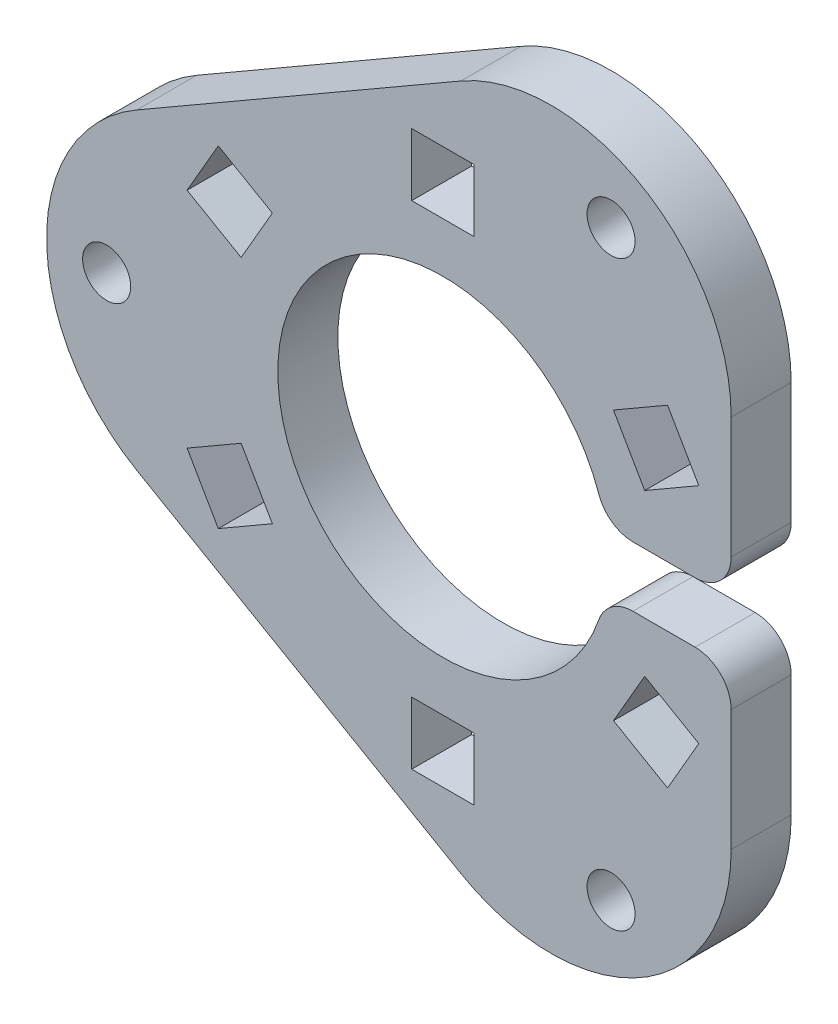
from build123d import *

# Parameters (mm, degrees)
SKETCH1_R           = 2
SKETCH1_W           = 5.2
SKETCH1_H           = 5.2
BOSS_EXTRUDE1_DEPTH = 5
CONG_1_R            = 15
CONG_2_R            = 3


with BuildPart() as part:
    # Sketch1 → Boss-Extrude1 (new body)
    with BuildSketch(Plane.XY):
        with BuildLine():
            Line((24, 2.5), (13.520817283, 2.5))
            ThreePointArc((13.520817283, 2.5), (-13.75, 0), (13.520817283, -2.5))
            Line((13.520817283, -2.5), (24, -2.5))
            Line((24, -2.5), (24, -41.569219382))
            Line((24, -41.569219382), (-48, 0))
            Line((-48, 0), (24, 41.569219382))
            Line((24, 41.569219382), (24, 2.5))
        make_face()
        with Locations((14, 24.248711306)):
            Circle(SKETCH1_R, mode=Mode.SUBTRACT)
        with Locations((14, -24.248711306)):
            Circle(SKETCH1_R, mode=Mode.SUBTRACT)
        with Locations((-28, 0)):
            Circle(SKETCH1_R, mode=Mode.SUBTRACT)
        with Locations((0, 20.5)):
            Rectangle(SKETCH1_W, SKETCH1_H, mode=Mode.SUBTRACT)
        Polygon((21.305186827, 9.29833395), (16.801854728, 6.69833395), (14.201854728, 11.20166605), (18.705186827, 13.80166605), align=None, mode=Mode.SUBTRACT)
        Polygon((18.705186827, -13.80166605), (14.201854728, -11.20166605), (16.801854728, -6.69833395), (21.305186827, -9.29833395), align=None, mode=Mode.SUBTRACT)
        with Locations((0, -20.5)):
            Rectangle(SKETCH1_W, SKETCH1_H, mode=Mode.SUBTRACT)
        Polygon((-21.305186827, -9.29833395), (-16.801854728, -6.69833395), (-14.201854728, -11.20166605), (-18.705186827, -13.80166605), align=None, mode=Mode.SUBTRACT)
        Polygon((-18.705186827, 13.80166605), (-14.201854728, 11.20166605), (-16.801854728, 6.69833395), (-21.305186827, 9.29833395), align=None, mode=Mode.SUBTRACT)
    extrude(amount=BOSS_EXTRUDE1_DEPTH)

    # Congé1
    cong_1_edges = [part.edges().sort_by_distance(p)[0] for p in [
        (24, -41.569219382, 2.5),
        (-48, 0, 2.5),
        (24, 41.569219382, 2.5),
    ]]
    fillet(cong_1_edges, radius=CONG_1_R)

    # Congé2
    cong_2_edges = [part.edges().sort_by_distance(p)[0] for p in [
        (24, 2.5, 2.5),
        (13.520817283, 2.5, 2.5),
        (13.520817283, -2.5, 2.5),
        (24, -2.5, 2.5),
    ]]
    fillet(cong_2_edges, radius=CONG_2_R)


solid = part.part
